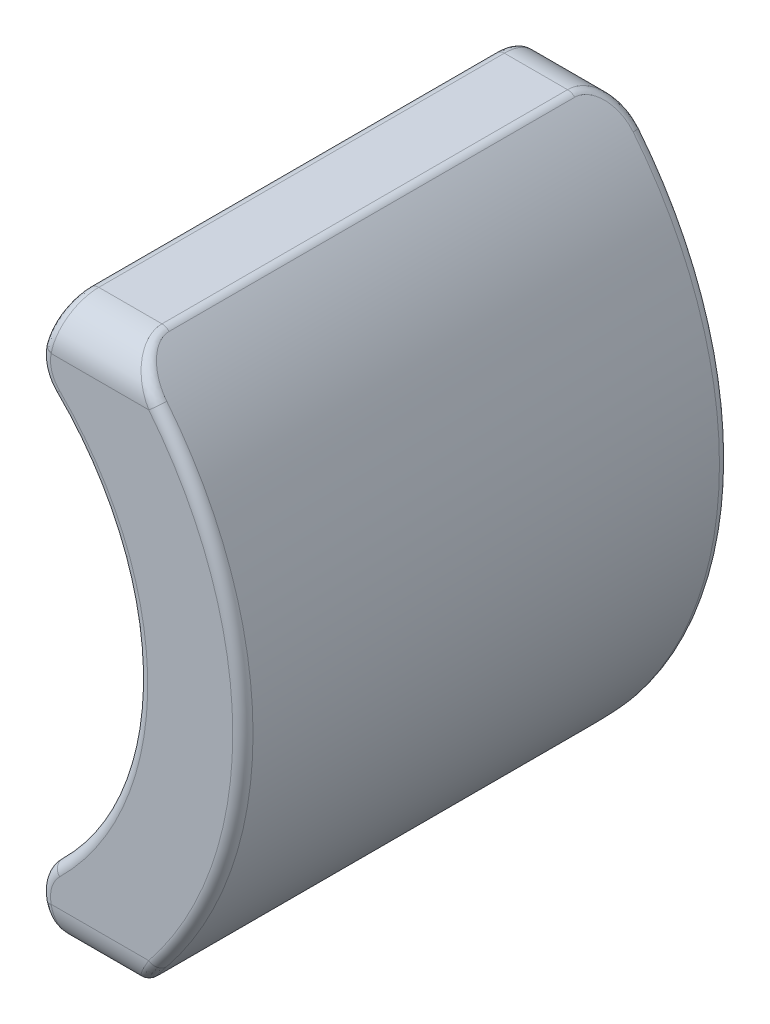
from build123d import *

# Parameters (mm, degrees)
BOSS_EXTRUDE1_DEPTH = 12
FILLET1_R           = 1
FILLET2_R           = 1
FILLET3_R           = 0.25


with BuildPart() as part:
    # Sketch1 → Boss-Extrude1 (new body)
    with BuildSketch(Plane.XY):
        with BuildLine():
            Line((6.738137725, -6.88), (4.878137725, -6.88))
            Line((4.878137725, -6.88), (4.531835438, -5.38))
            ThreePointArc((4.531835438, -5.38), (7.034339517, 0), (4.531835438, 5.38))
            Line((4.531835438, 5.38), (4.878137725, 6.88))
            Line((4.878137725, 6.88), (6.738137725, 6.88))
            ThreePointArc((6.738137725, 6.88), (9.63, 0), (6.738137725, -6.88))
        make_face()
    extrude(amount=BOSS_EXTRUDE1_DEPTH)

    # Fillet1
    fillet1_edges = [part.edges().sort_by_distance(p)[0] for p in [
        (4.531835438, -5.38, 6),
        (4.531835438, 5.38, 6),
    ]]
    fillet(fillet1_edges, radius=FILLET1_R)

    # Fillet2
    fillet2_edges = [part.edges().sort_by_distance(p)[0] for p in [
        (5.808137725, 6.88, 0),
        (5.808137725, -6.88, 0),
        (5.808137725, -6.88, 12),
        (5.808137725, 6.88, 12),
    ]]
    fillet(fillet2_edges, radius=FILLET2_R)

    # Fillet3
    fillet3_edges = [part.edges().sort_by_distance(p)[0] for p in [
        (7.034339517, 0, 0),
        (4.687877266, 5.411310183, 0),
        (7.034339517, 0, 12),
        (4.687877266, -5.411310183, 12),
        (4.878137725, 6.88, 6),
        (6.738137725, 6.88, 6),
        (4.815123489, 6.607055355, 11.686578845),
        (4.815123489, 6.607055355, 0.313421155),
        (4.687877266, 5.411310183, 12),
        (4.655934776, 5.914769544, 11.99939535),
        (4.655934776, 5.914769544, 0.00060465),
        (4.687877266, -5.411310183, 0),
        (9.63, 0, 0),
        (9.63, 0, 12),
        (6.738137725, -6.88, 6),
        (7.064336577, 6.544619807, 11.7471817),
        (7.064336589, -6.544619821, 11.747181705),
        (7.064336577, -6.544619807, 0.2528183),
        (7.064336577, 6.544619807, 0.2528183),
        (4.878137725, -6.88, 6),
        (4.655934772, -5.914769545, 11.999395357),
        (4.655934772, -5.914769545, 0.000604643),
        (4.815123489, -6.607055355, 11.686578845),
        (4.815123489, -6.607055355, 0.313421155),
    ]]
    fillet(fillet3_edges, radius=FILLET3_R)


solid = part.part
